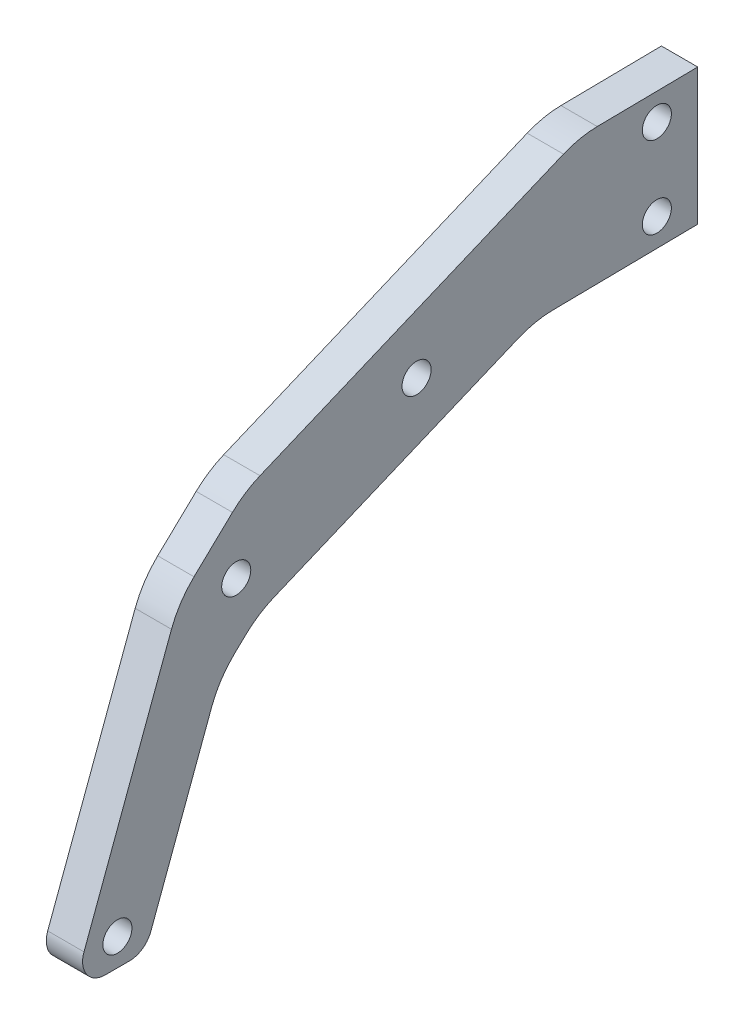
from build123d import *

# Parameters (mm, degrees)
SKETCH1_R           = 1.6
BOSS_EXTRUDE1_DEPTH = 4
FILLET1_R           = 10


with BuildPart() as part:
    # Sketch1 → Boss-Extrude1 (new body)
    with BuildSketch(Plane(origin=(0, 0, 0), x_dir=(0, 0, -1), z_dir=(1, 0, 0))):
        with BuildLine():
            Line((3.594627394, 0), (6.26129406, 0))
            ThreePointArc((6.26129406, 0), (7.688720424, 0.447573637), (8.60504406, 1.630036818))
            Line((8.60504406, 1.630036818), (16.138282763, 21.925181005))
            Line((16.138282763, 21.925181005), (20.42668985, 26.002896629))
            Line((20.42668985, 26.002896629), (50.91386883, 38.739566173))
            Line((50.91386883, 38.739566173), (68.844719883, 38.977888478))
            Line((68.844719883, 38.977888478), (68.844719883, 53.977888478))
            Line((68.844719883, 53.977888478), (55.845867993, 53.805118299))
            Line((55.845867993, 53.805118299), (18.937282625, 38.385769218))
            Line((18.937282625, 38.385769218), (11.690435574, 31.494963182))
            Line((11.690435574, 31.494963182), (1.250877394, 3.369963182))
            ThreePointArc((1.250877394, 3.369963182), (1.54220103, 1.072573637), (3.594627394, 0))
        make_face()
        with Locations((64.344719883, 50.977888478)):
            Circle(SKETCH1_R, mode=Mode.SUBTRACT)
        with Locations((4.927960727, 3)):
            Circle(SKETCH1_R, mode=Mode.SUBTRACT)
        with Locations((18.016916415, 30.611068767)):
            Circle(SKETCH1_R, mode=Mode.SUBTRACT)
        with Locations((37.879973994, 39.796930611)):
            Circle(SKETCH1_R, mode=Mode.SUBTRACT)
        with Locations((64.340323045, 41.977889552)):
            Circle(SKETCH1_R, mode=Mode.SUBTRACT)
    extrude(amount=BOSS_EXTRUDE1_DEPTH)

    # Fillet1
    fillet1_edges = [part.edges().sort_by_distance(p)[0] for p in [
        (2, 21.925181005, -16.138282763),
        (2, 26.002896629, -20.42668985),
        (2, 38.739566173, -50.91386883),
        (2, 53.805118299, -55.845867993),
        (2, 38.385769218, -18.937282625),
        (2, 31.494963182, -11.690435574),
    ]]
    fillet(fillet1_edges, radius=FILLET1_R)


solid = part.part
